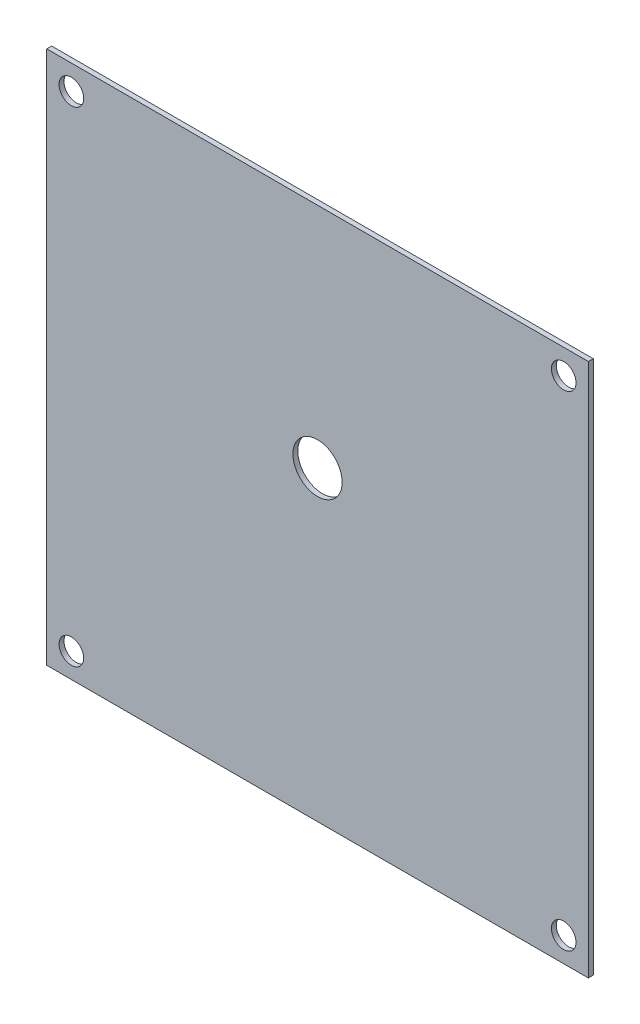
from build123d import *

# Parameters (mm, degrees)
SKETCH1_W           = 279.4
SKETCH1_H           = 275.43125
SKETCH1_R           = 6.35
SKETCH1_R_2         = 12.7
BOSS_EXTRUDE1_DEPTH = 2.54


with BuildPart() as part:
    # Sketch1 → Boss-Extrude1 (new body)
    with BuildSketch(Plane.XY):
        Rectangle(SKETCH1_W, SKETCH1_H)
        with Locations((-127, 125.015625)):
            Circle(SKETCH1_R, mode=Mode.SUBTRACT)
        with Locations(Location((-127, -125.015625, 0), (0, 0, 180))):
            Circle(SKETCH1_R, mode=Mode.SUBTRACT)
        with Locations((127, -125.015625)):
            Circle(SKETCH1_R, mode=Mode.SUBTRACT)
        with Locations(Location((127, 125.015625, 0), (0, 0, 180))):
            Circle(SKETCH1_R, mode=Mode.SUBTRACT)
        with Locations((0, 20.240625)):
            Circle(SKETCH1_R_2, mode=Mode.SUBTRACT)
    extrude(amount=BOSS_EXTRUDE1_DEPTH)


solid = part.part
